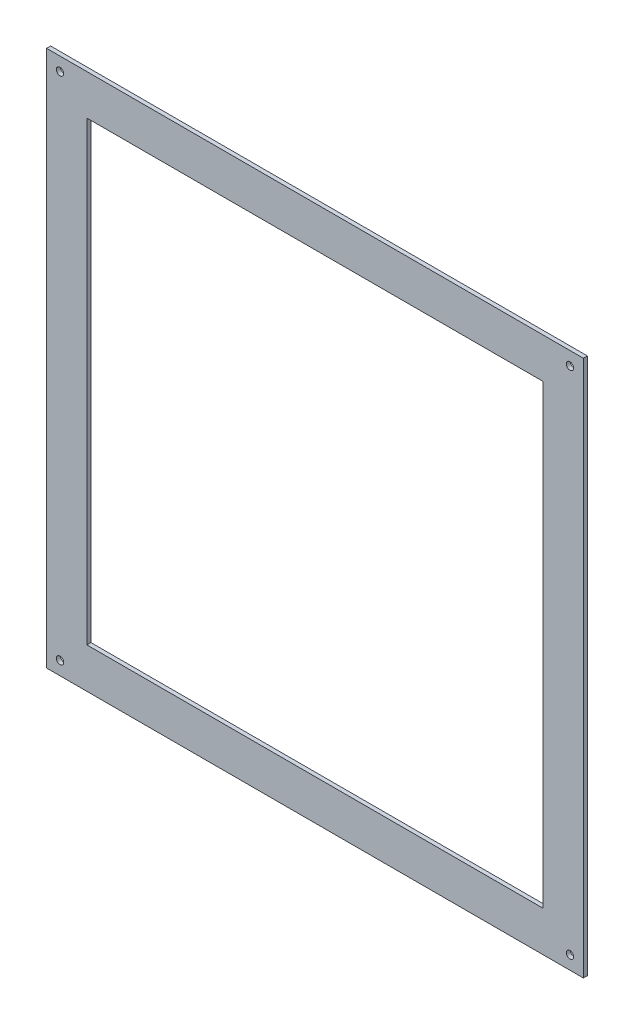
from build123d import *

# Parameters (mm, degrees)
ESQUISSE1_W        = 400
ESQUISSE1_H        = 400
ESQUISSE1_W_2      = 340
ESQUISSE1_H_2      = 340
BOSS_EXTRU_1_DEPTH = 3
D_GAGEMENT_M51_D   = 5.5


with BuildPart() as part:
    # Esquisse1 → Boss.-Extru.1 (new body)
    with BuildSketch(Plane.XY):
        Rectangle(ESQUISSE1_W, ESQUISSE1_H)
        Rectangle(ESQUISSE1_W_2, ESQUISSE1_H_2, mode=Mode.SUBTRACT)
    extrude(amount=BOSS_EXTRU_1_DEPTH)

    # Dégagement M51 (through all)
    with Locations(Plane.XY.offset(3)):
        with Locations((-190, -190), (-190, 190), (190, 190), (190, -190)):
            Hole(D_GAGEMENT_M51_D / 2)


solid = part.part
